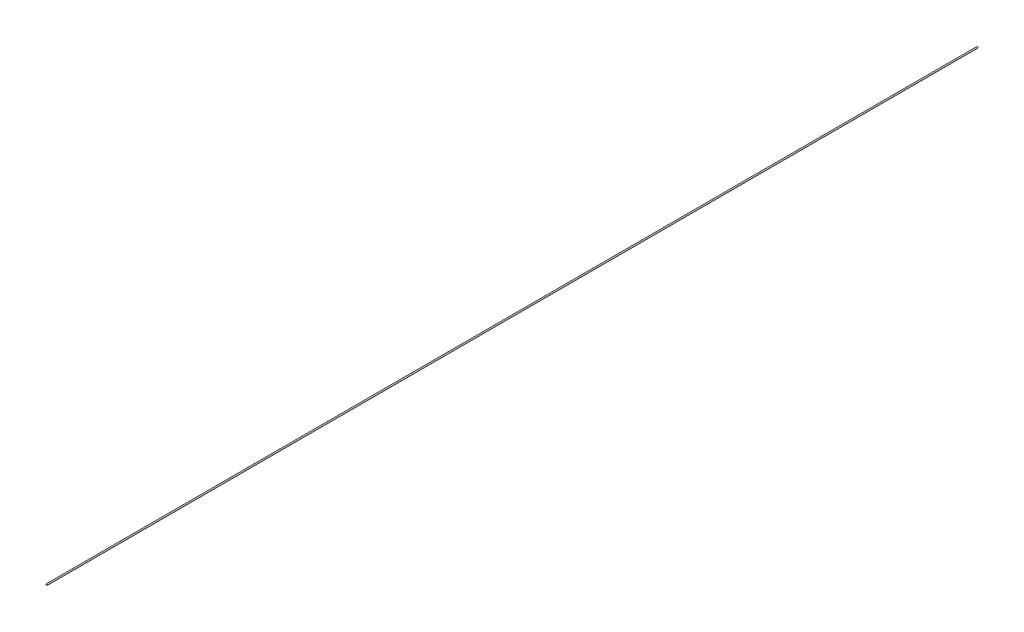
from build123d import *

# Parameters (mm, degrees)
SKETCH1_R           = 30
BOSS_EXTRUDE1_DEPTH = 40000


with BuildPart() as part:
    # Sketch1 → Boss-Extrude1 (new body)
    with BuildSketch(Plane.XY):
        with Locations((2.728077783, 0)):
            Circle(SKETCH1_R)
    extrude(amount=BOSS_EXTRUDE1_DEPTH)


solid = part.part
